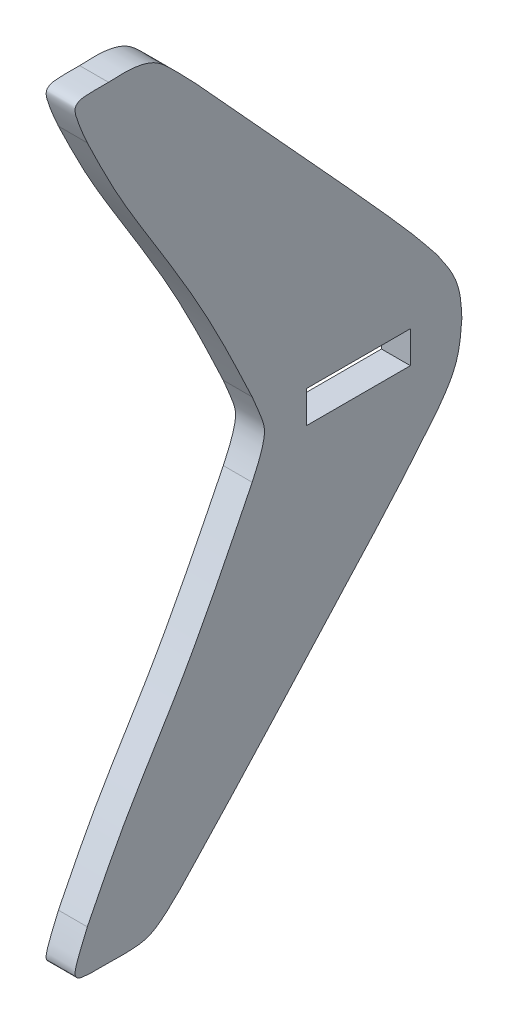
from build123d import *

# Parameters (mm, degrees)
SALIENTE_EXTRUIR1_DEPTH = 2.7


with BuildPart() as part:
    # Croquis1 → Saliente-Extruir1 (new body)
    with BuildSketch(Plane.YZ):
        with BuildLine():
            add(Edge.make_bspline(
                [(6.293439228, -15.775522485), (5.121962142, -16.593632507), (3.194137839, -17.939943421), (0.871254985, -18.056856227), (-0.040086355, -18.102724865)],
                knots=[0, 0, 0, 0, 0.607667972, 1, 1, 1, 1], degree=3))
            add(Edge.make_bspline(
                [(-0.040086355, -18.102724865), (-1.201974654, -18.009829097), (-3.52960923, -17.823729331), (-5.424560604, -16.459011542), (-6.373545472, -15.775522485)],
                knots=[0, 0, 0, 0, 0.499171871, 1, 1, 1, 1], degree=3))
            add(Edge.make_bspline(
                [(-6.373545472, -15.775522485), (-7.804862353, -14.601238141), (-11.07558572, -11.917863625), (-14.194675958, -9.059264094), (-15.948801542, -7.451629963)],
                knots=[0, 0, 0, 0, 0.437614778, 1, 1, 1, 1], degree=3))
            add(Edge.make_bspline(
                [(-15.948801542, -7.451629963), (-17.443388463, -6.10218116), (-20.530431809, -3.314918078), (-24.770274629, 0.536312591), (-28.467294634, 3.917288838), (-30.554741006, 5.878609194), (-31.49891708, 6.765750406)],
                knots=[0, 0, 0, 0, 0.286704657, 0.592183493, 0.815537105, 1, 1, 1, 1], degree=3))
            add(Edge.make_bspline(
                [(-31.49891708, 6.765750406), (-32.438822541, 7.635466475), (-33.894427025, 8.982370671), (-35.507559417, 11.007833432), (-35.713078645, 12.975472223), (-35.687723833, 14.194321553), (-35.672718902, 14.914892037)],
                knots=[0, 0, 0, 0, 0.40036792, 0.620038252, 0.775370742, 1, 1, 1, 1], degree=3))
            add(Edge.make_bspline(
                [(-35.672718902, 14.914892037), (-35.680689094, 15.639451674), (-35.690874791, 16.565419984), (-35.586054884, 17.634008996), (-35.221194824, 18.102724865), (-34.550677182, 18.007362541), (-33.425998925, 17.608351417), (-32.472200247, 17.20046624), (-31.763213091, 16.897275135)],
                knots=[0, 0, 0, 0, 0.316944263, 0.405046498, 0.463446105, 0.551890516, 0.666909176, 1, 1, 1, 1], degree=3))
            add(Edge.make_bspline(
                [(-31.763213091, 16.897275135), (-29.525822617, 15.781269732), (-24.541657724, 13.295179343), (-15.527263963, 7.429291582), (-8.131966695, 3.780675765), (-3.490287323, 1.490633478)],
                knots=[0, 0, 0, 0, 0.232717522, 0.518417556, 1, 1, 1, 1], degree=3))
            add(Edge.make_bspline(
                [(-3.490287323, 1.490633478), (-2.739069016, 1.146742809), (-1.552350155, 0.603489886), (0.206643558, 0.218203753), (1.746992984, 0.788773893), (2.774249384, 1.222278318), (3.41018108, 1.490633478)],
                knots=[0, 0, 0, 0, 0.341130867, 0.538893194, 0.714557953, 1, 1, 1, 1], degree=3))
            add(Edge.make_bspline(
                [(3.41018108, 1.490633478), (6.392233349, 2.895112996), (12.310419911, 5.682445699), (19.846239343, 10.308731434), (26.181207451, 14.233722821), (29.967258265, 16.066658656), (31.682979537, 16.897275135)],
                knots=[0, 0, 0, 0, 0.306659051, 0.608596131, 0.822630723, 1, 1, 1, 1], degree=3))
            add(Edge.make_bspline(
                [(31.682979537, 16.897275135), (32.513328743, 17.263685023), (33.540008962, 17.716730297), (34.719454724, 18.063183238), (35.207348957, 18.027712416), (35.503576328, 17.632491508), (35.613512678, 16.567275152), (35.60175886, 15.640265975), (35.592564917, 14.914892037)],
                knots=[0, 0, 0, 0, 0.394572904, 0.487867264, 0.536933985, 0.595286244, 0.683316176, 1, 1, 1, 1], degree=3))
            add(Edge.make_bspline(
                [(35.592564917, 14.914892037), (35.63716636, 14.039760306), (35.713078645, 12.550273754), (35.099962352, 10.424635865), (33.440384597, 8.704076796), (32.193829883, 7.508885437), (31.41875862, 6.765750406)],
                knots=[0, 0, 0, 0, 0.271148289, 0.461498213, 0.665175338, 1, 1, 1, 1], degree=3))
            Line((31.41875862, 6.765750406), (15.868633502, -7.451629963))
            add(Edge.make_bspline(
                [(15.868633502, -7.451629963), (14.660790378, -8.539574174), (12.528375778, -10.460262806), (9.386512886, -13.29436609), (7.354529376, -14.924349411), (6.293439228, -15.775522485)],
                knots=[0, 0, 0, 0, 0.38432297, 0.678495048, 1, 1, 1, 1], degree=3))
        make_face()
        Polygon((1.556751969, -3.588558087), (-1.443248031, -3.588553212), (-1.443248031, -13.288553212), (1.547027392, -13.288553212), align=None, mode=Mode.SUBTRACT)
    extrude(amount=SALIENTE_EXTRUIR1_DEPTH)


solid = part.part
